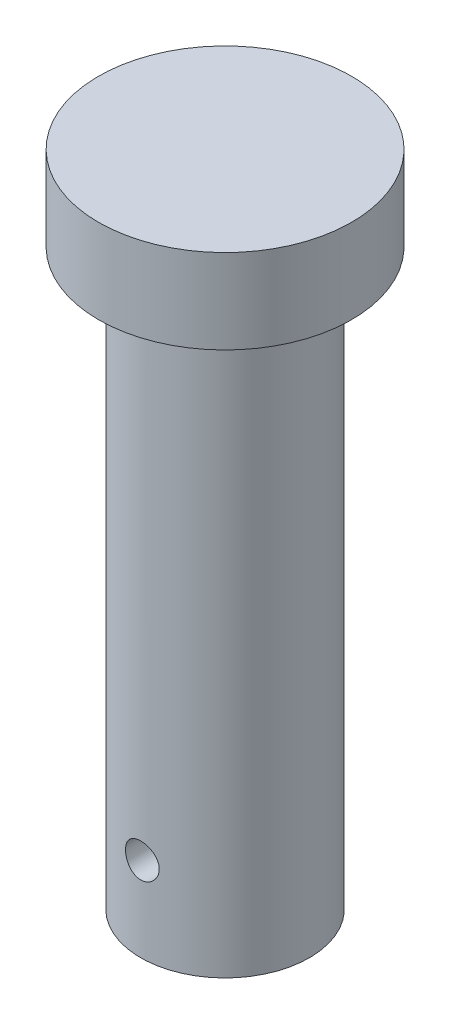
from build123d import *

# Parameters (mm, degrees)
CROQUIS1_R              = 22.5
SALIENTE_EXTRUIR1_DEPTH = 15
CROQUIS2_R              = 15
SALIENTE_EXTRUIR2_DEPTH = 102
CROQUIS3_R              = 3
CORTAR_EXTRUIR1_DEPTH   = 51


with BuildPart() as part:
    # Croquis1 → Saliente-Extruir1 (new body)
    with BuildSketch(Plane(origin=(0, 0, 0), x_dir=(1, 0, 0), z_dir=(0, 1, 0))):
        with Locations(Location((0, 0, 0), (0, 0, 270))):
            Circle(CROQUIS1_R)
    extrude(amount=-SALIENTE_EXTRUIR1_DEPTH)

    # Croquis2 → Saliente-Extruir2 (add)
    with BuildSketch(Plane.XZ.offset(15)):
        with Locations(Location((0, 0, 0), (0, 0, 270))):
            Circle(CROQUIS2_R)
    extrude(amount=SALIENTE_EXTRUIR2_DEPTH)

    # Croquis3 → Cortar-Extruir1 (cut, symmetric)
    with BuildSketch(Plane.XY):
        with Locations(Location((0, -102, 0), (0, 0, 269.999999956))):
            Circle(CROQUIS3_R)
    extrude(amount=CORTAR_EXTRUIR1_DEPTH, both=True, mode=Mode.SUBTRACT)


solid = part.part
